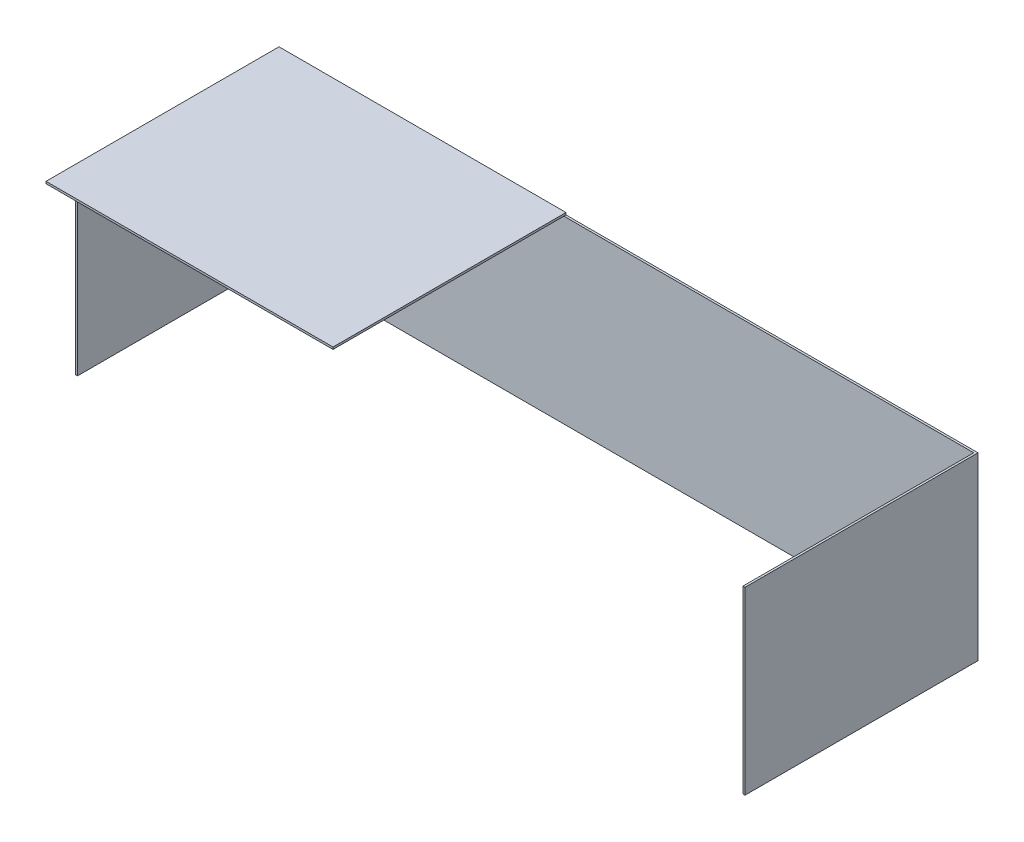
from build123d import *

# Parameters (mm, degrees)
SALIENTE_EXTRUIR1_DEPTH = 170
CROQUIS2_W              = 271.012090605
CROQUIS2_H              = 220
SALIENTE_EXTRUIR2_DEPTH = 2


with BuildPart() as part:
    # Croquis1 → Saliente-Extruir1 (new body)
    with BuildSketch(Plane(origin=(0, 0, 0), x_dir=(1, 0, 0), z_dir=(0, 1, 0))):
        Polygon((-305.737821636, -89.613714521), (-305.737821636, 100.579273879), (350.262178364, 100.579273879), (350.262178364, -117.420726121), (352.262178364, -117.420726121), (352.262178364, 102.579273879), (-307.737821636, 102.579273879), (-307.737821636, -89.613714521), align=None)
    extrude(amount=SALIENTE_EXTRUIR1_DEPTH)

    # Croquis2 → Saliente-Extruir2 (add)
    with BuildSketch(Plane(origin=(0, 170, 0), x_dir=(1, 0, 0), z_dir=(0, 1, 0))):
        with Locations((-172.231776334, -7.420726121)):
            Rectangle(CROQUIS2_W, CROQUIS2_H)
    extrude(amount=SALIENTE_EXTRUIR2_DEPTH)


solid = part.part
